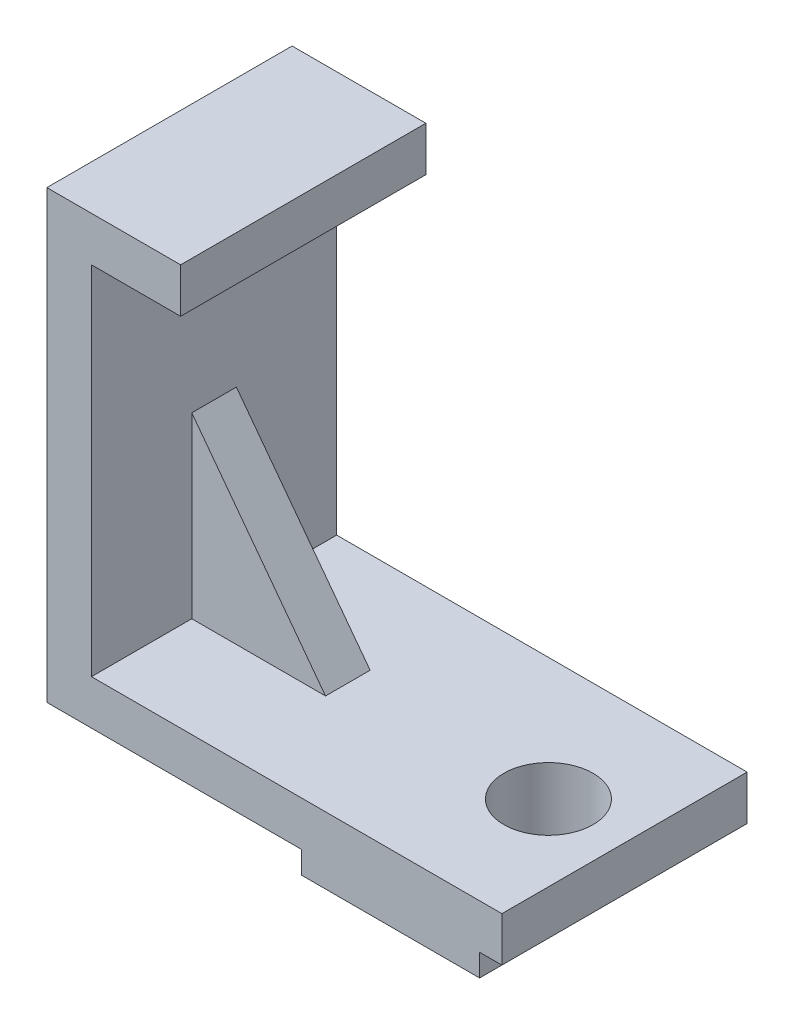
from build123d import *

# Parameters (mm, degrees)
BOSS_EXTRUDE1_DEPTH = 55
RIB1_REACH          = 99.208
SKETCH2_WALL_W      = 246.416860904
SKETCH2_WALL_H      = 10
SKETCH3_R           = 10
CUT_EXTRUDE1_DEPTH  = 120.917878263


with BuildPart() as part:
    # Sketch1 → Boss-Extrude1 (new body)
    with BuildSketch(Plane.XY):
        Polygon((-27.055214724, 21.257668712), (-27.055214724, 31.257668712), (-57.055214724, 31.257668712), (-57.055214724, -68.742331288), (0, -68.742331288), (0, -73.742331288), (40, -73.742331288), (40, -68.742331288), (45, -68.742331288), (45, -58.742331288), (-47.055214724, -58.742331288), (-47.055214724, 21.257668712), align=None)
    extrude(amount=BOSS_EXTRUDE1_DEPTH)

    # Sketch2 wall → Rib1 (add, up to next)
    with BuildSketch(Plane(origin=(-32.055214724, -38.742331288, 27.5), x_dir=(0.6, -0.8, 0), z_dir=(0.8, 0.6, 0)), mode=Mode.PRIVATE) as rib1_sk1:
        Rectangle(SKETCH2_WALL_W, SKETCH2_WALL_H)
    rib1_tool1 = extrude(rib1_sk1.sketch, amount=-RIB1_REACH, mode=Mode.PRIVATE) - part.part
    add(rib1_tool1.solids().sort_by_distance((-32.055214724, -38.742331288, 27.5))[0])

    # Sketch3 → Cut-Extrude1 (cut, through all)
    with BuildSketch(Plane(origin=(0, -58.742331288, 0), x_dir=(1, 0, 0), z_dir=(0, 1, 0))):
        with Locations(Location((27.944785276, -27.5, 0), (0, 0, 180))):
            Circle(SKETCH3_R)
    extrude(amount=-CUT_EXTRUDE1_DEPTH, mode=Mode.SUBTRACT)


solid = part.part
